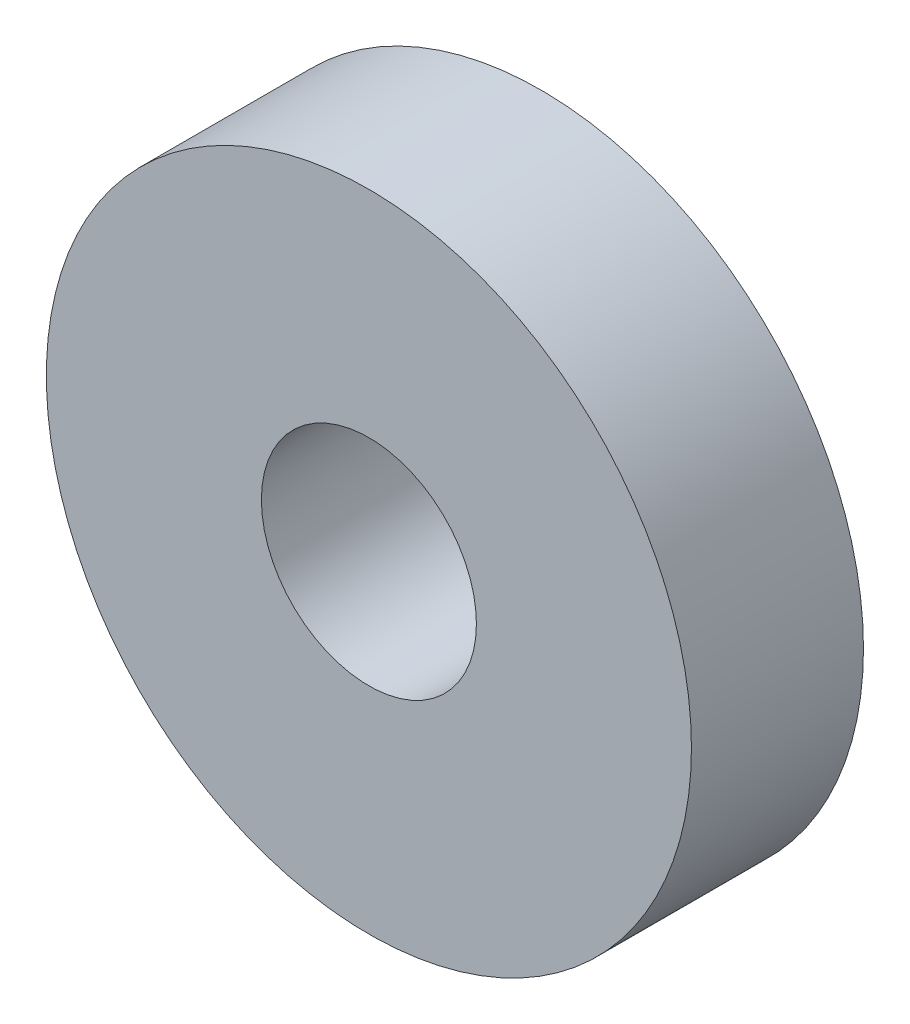
from build123d import *

# Parameters (mm, degrees)
SKETCH_2_R      = 7.5
SKETCH_2_R_2    = 2.5
EXTRUDE_1_DEPTH = 4


with BuildPart() as part:
    # 草图2 → 凸台-拉伸1 (new body)
    with BuildSketch(Plane.XY):
        Circle(SKETCH_2_R)
        Circle(SKETCH_2_R_2, mode=Mode.SUBTRACT)
    extrude(amount=EXTRUDE_1_DEPTH)


solid = part.part
